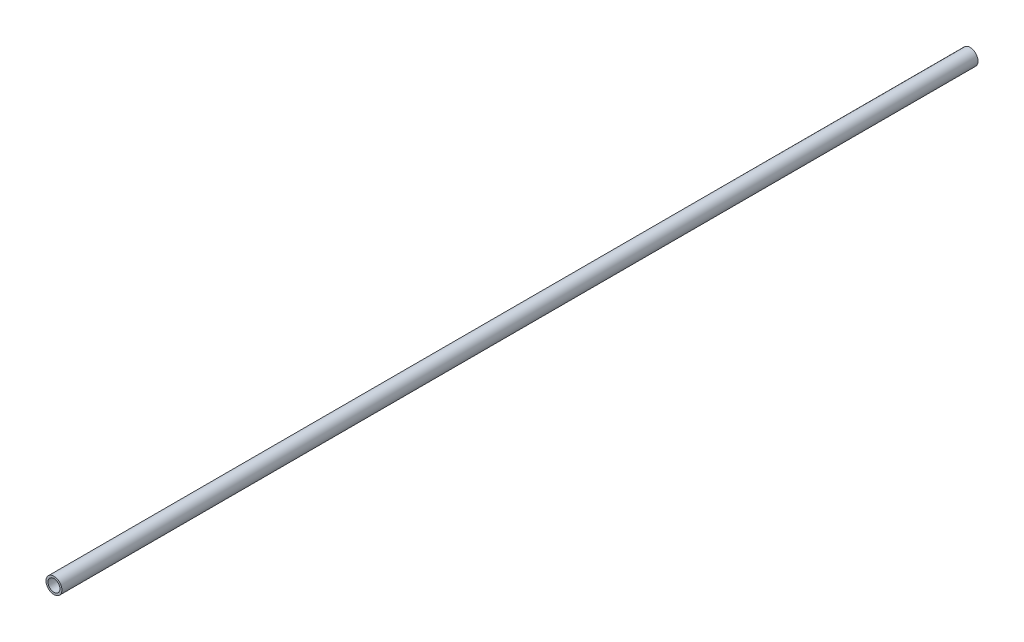
from build123d import *

# Parameters (mm, degrees)
SKETCH_1_R      = 4
SKETCH_1_R_2    = 3
EXTRUDE_1_DEPTH = 460


with BuildPart() as part:
    # 草图1 → 凸台-拉伸1 (new body)
    with BuildSketch(Plane.XY):
        Circle(SKETCH_1_R)
        Circle(SKETCH_1_R_2, mode=Mode.SUBTRACT)
    extrude(amount=EXTRUDE_1_DEPTH)


solid = part.part
